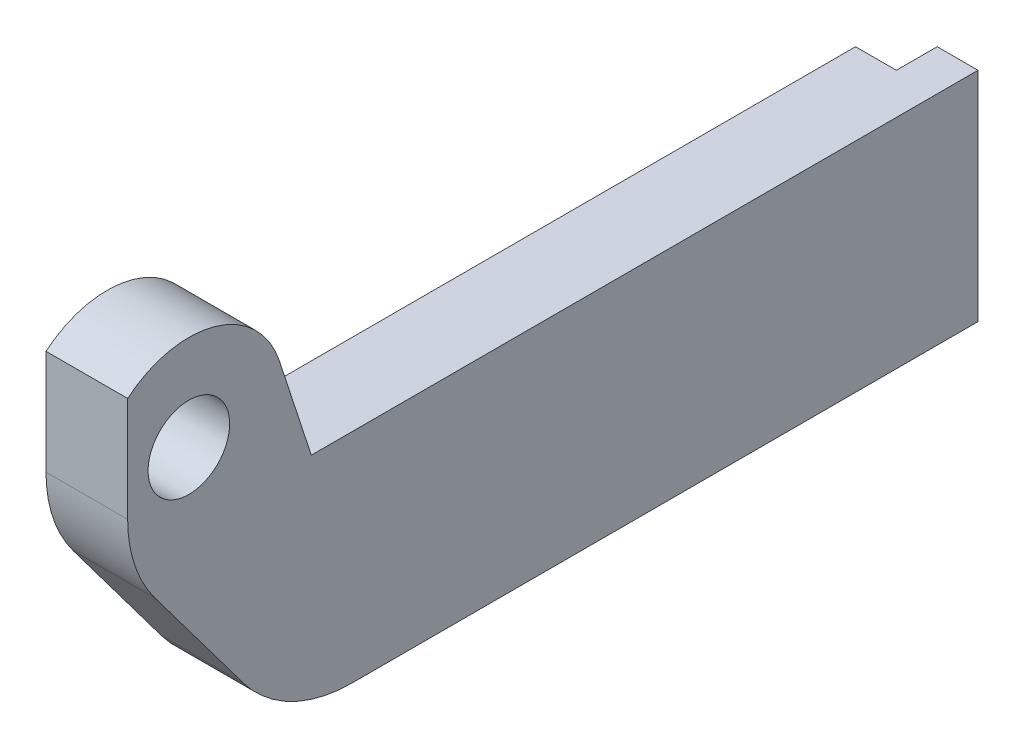
from build123d import *

# Parameters (mm, degrees)
TAB_EXTRUDE_DEPTH       = 8
SKETCH3_R               = 1.5
SCREWHOLE_EXTRUDE_DEPTH = 3
STRUCTURAL_ROUNDING_R   = 5


with BuildPart() as part:
    # Sketch1 → Tab extrude (new body)
    with BuildSketch(Plane.XZ.offset(-69.5)):
        Polygon((-1, 0.185), (-1, -25.315), (-2.5, -25.315), (-2.5, -23.815), (-4, -23.815), (-4, 0.185), align=None)
    extrude(amount=-TAB_EXTRUDE_DEPTH)

    # Sketch3 → Screwhole extrude (add)
    with BuildSketch(Plane.ZY.offset(1)):
        with BuildLine():
            Line((0.185, 69.5), (5.935, 77.166666667))
            Line((5.935, 77.166666667), (5.935, 82.680951324))
            ThreePointArc((5.935, 82.680951324), (2.723639085, 83.365380393), (0.35837639, 81.087922497))
            Line((0.35837639, 81.087922497), (-0.815, 77.5))
            Line((-0.815, 77.5), (0.185, 77.5))
            Line((0.185, 77.5), (0.185, 69.5))
        make_face()
        with Locations((3.685, 80)):
            Circle(SKETCH3_R, mode=Mode.SUBTRACT)
    extrude(amount=SCREWHOLE_EXTRUDE_DEPTH)

    # Structural rounding
    structural_rounding_edges = [part.edges().sort_by_distance(p)[0] for p in [
        (-2.5, 77.166666667, 5.935),
        (-2.5, 69.5, 0.185),
    ]]
    fillet(structural_rounding_edges, radius=STRUCTURAL_ROUNDING_R)


solid = part.part
